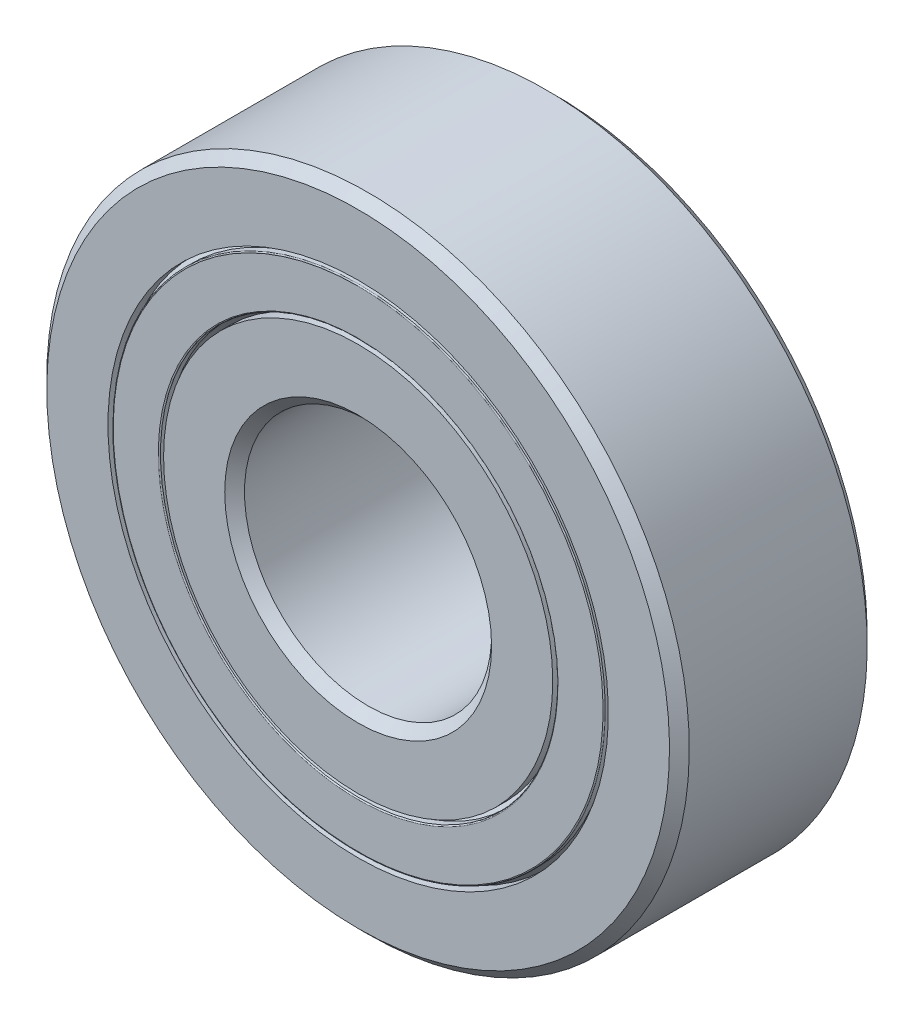
from build123d import *

# Parameters (mm, degrees)
CIRPATTERN1_COUNT   = 10
SKETCH7_R           = 9.5625
SKETCH7_R_2         = 9
BOSS_EXTRUDE1_DEPTH = 0.666666667
FILLET1_R           = 0.044444444
FILLET2_R           = 0.044444444


with BuildPart() as part:
    # Sketch3 → Revolve1 (revolve)
    with BuildSketch(Plane(origin=(0, 0, 0), x_dir=(0, 0, -1), z_dir=(1, 0, 0)), mode=Mode.PRIVATE) as revolve1_sk:
        with BuildLine():
            Line((3.6, 13), (4, 12.6))
            Line((4, 12.6), (4, 10.125))
            Line((4, 10.125), (1.777777778, 10.125))
            ThreePointArc((1.777777778, 10.125), (0, 11.103834316), (-1.777777778, 10.125))
            Line((-1.777777778, 10.125), (-4, 10.125))
            Line((-4, 10.125), (-4, 12.6))
            Line((-4, 12.6), (-3.6, 13))
            Line((-3.6, 13), (3.6, 13))
        make_face()
    revolve(revolve1_sk.sketch.rotate(Axis((0, 0, 4), (0, 0, -1)), 180), axis=Axis((0, 0, 4), (0, 0, -1)))


with BuildPart() as body_2:
    # Sketch4 → Revolve2 (revolve)
    with BuildSketch(Plane(origin=(0, 0, 0), x_dir=(0, 0, -1), z_dir=(1, 0, 0)), mode=Mode.PRIVATE) as revolve2_sk:
        with BuildLine():
            Line((-3.6, 5), (-4, 5.4))
            Line((-4, 5.4), (-4, 7.875))
            Line((-4, 7.875), (-1.777777778, 7.875))
            ThreePointArc((-1.777777778, 7.875), (0, 6.896165684), (1.777777778, 7.875))
            Line((1.777777778, 7.875), (4, 7.875))
            Line((4, 7.875), (4, 5.4))
            Line((4, 5.4), (3.6, 5))
            Line((3.6, 5), (-3.6, 5))
        make_face()
    revolve(revolve2_sk.sketch.rotate(Axis((0, 0, 4), (0, 0, -1)), 180), axis=Axis((0, 0, 4), (0, 0, -1)))


with BuildPart() as body_3:
    # Sketch5 → Revolve3 (revolve)
    with BuildSketch(Plane(origin=(0, 0, 0), x_dir=(0, 0, -1), z_dir=(1, 0, 0))):
        with BuildLine():
            Line((-2.103834316, 9), (2.103834316, 9))
            ThreePointArc((2.103834316, 9), (0, 11.103834316), (-2.103834316, 9))
        make_face()
    revolve(axis=Axis((0, 9, 2.103834316), (0, 0, -1)))


with BuildPart() as body_4:
    # Sketch6 → Revolve4 (revolve)
    with BuildSketch(Plane(origin=(0, 0, 0), x_dir=(0, 0, -1), z_dir=(1, 0, 0))):
        with BuildLine():
            Line((-2.027242604, 9.5625), (-2.356035504, 9.5625))
            ThreePointArc((-2.356035504, 9.5625), (-2.520431953, 9), (-2.356035504, 8.4375))
            Line((-2.356035504, 8.4375), (-2.027242604, 8.4375))
            ThreePointArc((-2.027242604, 8.4375), (-2.103834316, 9), (-2.027242604, 9.5625))
        make_face()
    revolve(axis=Axis((0, 13, 0), (0, -1, 0)))


with BuildPart() as cirpattern1_1:
    # CirPattern1: pattern copy
    add(body_4.part.rotate(Axis((0, 0, 0), (0, 0, 1)), 1 * 360 / CIRPATTERN1_COUNT))


with BuildPart() as cirpattern1_2:
    # CirPattern1: pattern copy
    add(body_4.part.rotate(Axis((0, 0, 0), (0, 0, 1)), 2 * 360 / CIRPATTERN1_COUNT))


with BuildPart() as cirpattern1_3:
    # CirPattern1: pattern copy
    add(body_4.part.rotate(Axis((0, 0, 0), (0, 0, 1)), 3 * 360 / CIRPATTERN1_COUNT))


with BuildPart() as cirpattern1_4:
    # CirPattern1: pattern copy
    add(body_4.part.rotate(Axis((0, 0, 0), (0, 0, 1)), 4 * 360 / CIRPATTERN1_COUNT))


with BuildPart() as cirpattern1_5:
    # CirPattern1: pattern copy
    add(body_4.part.rotate(Axis((0, 0, 0), (0, 0, 1)), 5 * 360 / CIRPATTERN1_COUNT))


with BuildPart() as cirpattern1_6:
    # CirPattern1: pattern copy
    add(body_4.part.rotate(Axis((0, 0, 0), (0, 0, 1)), 6 * 360 / CIRPATTERN1_COUNT))


with BuildPart() as cirpattern1_7:
    # CirPattern1: pattern copy
    add(body_4.part.rotate(Axis((0, 0, 0), (0, 0, 1)), 7 * 360 / CIRPATTERN1_COUNT))


with BuildPart() as cirpattern1_8:
    # CirPattern1: pattern copy
    add(body_4.part.rotate(Axis((0, 0, 0), (0, 0, 1)), 8 * 360 / CIRPATTERN1_COUNT))


with BuildPart() as cirpattern1_9:
    # CirPattern1: pattern copy
    add(body_4.part.rotate(Axis((0, 0, 0), (0, 0, 1)), 9 * 360 / CIRPATTERN1_COUNT))


with BuildPart() as cirpattern1_10:
    # CirPattern1: pattern copy
    add(body_3.part.rotate(Axis((0, 0, 0), (0, 0, 1)), 1 * 360 / CIRPATTERN1_COUNT))


with BuildPart() as cirpattern1_11:
    # CirPattern1: pattern copy
    add(body_3.part.rotate(Axis((0, 0, 0), (0, 0, 1)), 2 * 360 / CIRPATTERN1_COUNT))


with BuildPart() as cirpattern1_12:
    # CirPattern1: pattern copy
    add(body_3.part.rotate(Axis((0, 0, 0), (0, 0, 1)), 3 * 360 / CIRPATTERN1_COUNT))


with BuildPart() as cirpattern1_13:
    # CirPattern1: pattern copy
    add(body_3.part.rotate(Axis((0, 0, 0), (0, 0, 1)), 4 * 360 / CIRPATTERN1_COUNT))


with BuildPart() as cirpattern1_14:
    # CirPattern1: pattern copy
    add(body_3.part.rotate(Axis((0, 0, 0), (0, 0, 1)), 5 * 360 / CIRPATTERN1_COUNT))


with BuildPart() as cirpattern1_15:
    # CirPattern1: pattern copy
    add(body_3.part.rotate(Axis((0, 0, 0), (0, 0, 1)), 6 * 360 / CIRPATTERN1_COUNT))


with BuildPart() as cirpattern1_16:
    # CirPattern1: pattern copy
    add(body_3.part.rotate(Axis((0, 0, 0), (0, 0, 1)), 7 * 360 / CIRPATTERN1_COUNT))


with BuildPart() as cirpattern1_17:
    # CirPattern1: pattern copy
    add(body_3.part.rotate(Axis((0, 0, 0), (0, 0, 1)), 8 * 360 / CIRPATTERN1_COUNT))


with BuildPart() as cirpattern1_18:
    # CirPattern1: pattern copy
    add(body_3.part.rotate(Axis((0, 0, 0), (0, 0, 1)), 9 * 360 / CIRPATTERN1_COUNT))


with BuildPart() as body_23:
    # Sketch7 → Boss-Extrude1 (new, symmetric)
    with BuildSketch(Plane.XY):
        Circle(SKETCH7_R)
        Circle(SKETCH7_R_2, mode=Mode.SUBTRACT)
    extrude(amount=BOSS_EXTRUDE1_DEPTH, both=True)


with BuildPart() as body_24:
    # Sketch8 → Revolve5 (revolve)
    with BuildSketch(Plane(origin=(0, 0, 0), x_dir=(0, 0, -1), z_dir=(1, 0, 0)), mode=Mode.PRIVATE) as revolve5_sk:
        Polygon((-4, 9.95625), (-3.703703704, 9.95625), (-3.555555556, 10.125), (-3.555555556, 9.95625), (-3.555555556, 8.04375), (-3.555555556, 7.875), (-3.703703704, 8.04375), (-4, 8.04375), align=None)
        Polygon((4, 9.95625), (4, 8.04375), (3.703703704, 8.04375), (3.555555556, 7.875), (3.555555556, 8.04375), (3.555555556, 9.95625), (3.555555556, 10.125), (3.703703704, 9.95625), align=None)
    revolve(revolve5_sk.sketch.rotate(Axis((0, 0, 4), (0, 0, -1)), 180), axis=Axis((0, 0, 4), (0, 0, -1)))

    # Fillet1
    fillet1_edges = [body_24.edges().sort_by_distance(p)[0] for p in [
        (0, 9.95625, 4),
        (0, 8.04375, 4),
    ]]
    fillet(fillet1_edges, radius=FILLET1_R)

    # Fillet2
    fillet2_edges = [body_24.edges().sort_by_distance(p)[0] for p in [
        (0, 9.95625, -4),
        (0, 8.04375, -4),
    ]]
    fillet(fillet2_edges, radius=FILLET2_R)


solid = Compound([part.part, body_2.part, body_3.part, body_4.part, cirpattern1_1.part, cirpattern1_2.part, cirpattern1_3.part, cirpattern1_4.part, cirpattern1_5.part, cirpattern1_6.part, cirpattern1_7.part, cirpattern1_8.part, cirpattern1_9.part, cirpattern1_10.part, cirpattern1_11.part, cirpattern1_12.part, cirpattern1_13.part, cirpattern1_14.part, cirpattern1_15.part, cirpattern1_16.part, cirpattern1_17.part, cirpattern1_18.part, body_23.part, body_24.part])
